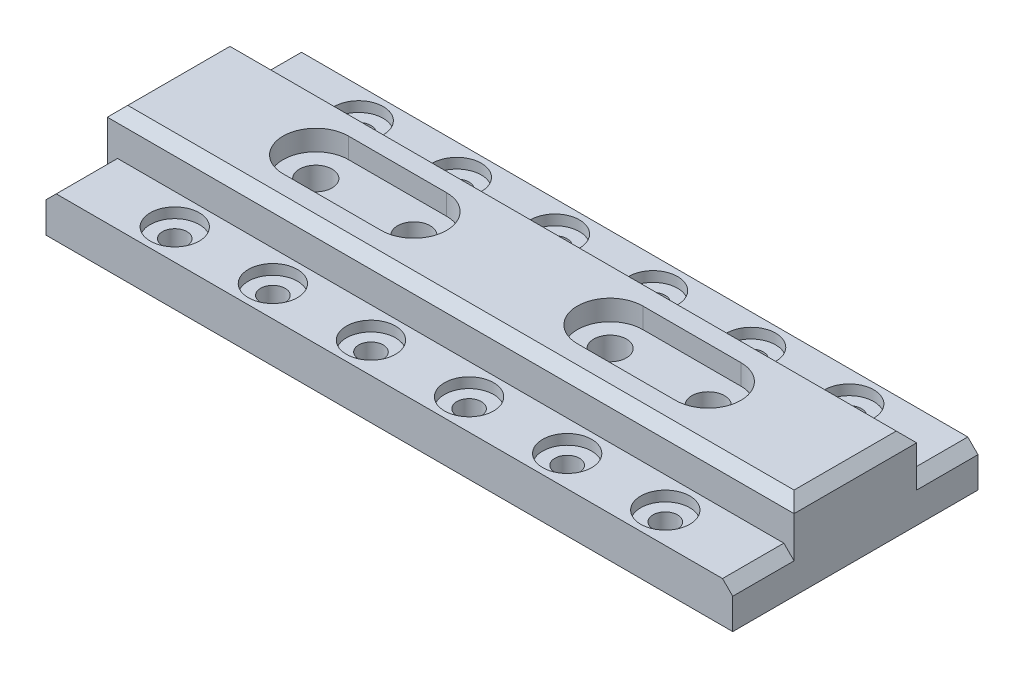
from build123d import *

# Parameters (mm, degrees)
BOSS_EXTRUDE1_DEPTH = 106.68
SKETCH3_R           = 3.81
CUT_EXTRUDE1_DEPTH  = 114.989132815
SKETCH5_R           = 7.62
CUT_EXTRUDE2_DEPTH  = 3.175
SKETCH6_R           = 5.08
CUT_EXTRUDE3_DEPTH  = 117.092172001
CUT_EXTRUDE4_DEPTH  = 6.35
CHAMFER1_SIZE       = 3.175


with BuildPart() as part:
    # Sketch1 → Boss-Extrude1 (new, symmetric)
    with BuildSketch(Plane(origin=(0, 0, 0), x_dir=(0, 0, -1), z_dir=(1, 0, 0))):
        Polygon((38.1, 0), (-38.1, 0), (-38.1, 12.7), (-19.05, 12.7), (-19.05, 25.4), (19.05, 25.4), (19.05, 12.7), (38.1, 12.7), align=None)
    extrude(amount=BOSS_EXTRUDE1_DEPTH, both=True)

    # Sketch3 → Cut-Extrude1 (cut, through all)
    with BuildSketch(Plane(origin=(0, 12.7, 0), x_dir=(1, 0, 0), z_dir=(0, 1, 0))):
        with Locations(Location((-76.2, -28.575, 0), (0, 0, 270))):
            Circle(SKETCH3_R)
        with Locations(Location((-45.72, -28.575, 0), (0, 0, 270))):
            Circle(SKETCH3_R)
        with Locations(Location((-15.24, -28.575, 0), (0, 0, 270))):
            Circle(SKETCH3_R)
        with Locations(Location((15.24, -28.575, 0), (0, 0, 270))):
            Circle(SKETCH3_R)
        with Locations(Location((45.72, -28.575, 0), (0, 0, 270))):
            Circle(SKETCH3_R)
        with Locations(Location((76.2, -28.575, 0), (0, 0, 270))):
            Circle(SKETCH3_R)
        with Locations(Location((76.2, 28.575, 0), (0, 0, 90))):
            Circle(SKETCH3_R)
        with Locations(Location((45.72, 28.575, 0), (0, 0, 90))):
            Circle(SKETCH3_R)
        with Locations(Location((15.24, 28.575, 0), (0, 0, 90))):
            Circle(SKETCH3_R)
        with Locations(Location((-15.24, 28.575, 0), (0, 0, 90))):
            Circle(SKETCH3_R)
        with Locations(Location((-45.72, 28.575, 0), (0, 0, 90))):
            Circle(SKETCH3_R)
        with Locations(Location((-76.2, 28.575, 0), (0, 0, 90))):
            Circle(SKETCH3_R)
    extrude(amount=-CUT_EXTRUDE1_DEPTH, mode=Mode.SUBTRACT)

    # Sketch5 → Cut-Extrude2 (cut)
    with BuildSketch(Plane(origin=(0, 12.7, 0), x_dir=(1, 0, 0), z_dir=(0, 1, 0))):
        with Locations(Location((-76.2, -28.575, 0), (0, 0, 270))):
            Circle(SKETCH5_R)
        with Locations(Location((-45.72, -28.575, 0), (0, 0, 270))):
            Circle(SKETCH5_R)
        with Locations(Location((-15.24, -28.575, 0), (0, 0, 270))):
            Circle(SKETCH5_R)
        with Locations(Location((15.24, -28.575, 0), (0, 0, 270))):
            Circle(SKETCH5_R)
        with Locations(Location((45.72, -28.575, 0), (0, 0, 270))):
            Circle(SKETCH5_R)
        with Locations(Location((76.2, -28.575, 0), (0, 0, 270))):
            Circle(SKETCH5_R)
        with Locations(Location((-45.72, 28.575, 0), (0, 0, 270))):
            Circle(SKETCH5_R)
        with Locations(Location((-15.24, 28.575, 0), (0, 0, 270))):
            Circle(SKETCH5_R)
        with Locations(Location((15.24, 28.575, 0), (0, 0, 270))):
            Circle(SKETCH5_R)
        with Locations(Location((45.72, 28.575, 0), (0, 0, 270))):
            Circle(SKETCH5_R)
        with Locations(Location((76.2, 28.575, 0), (0, 0, 270))):
            Circle(SKETCH5_R)
        with Locations(Location((-76.2, 28.575, 0), (0, 0, 270))):
            Circle(SKETCH5_R)
    extrude(amount=-CUT_EXTRUDE2_DEPTH, mode=Mode.SUBTRACT)

    # Sketch6 → Cut-Extrude3 (cut, through all)
    with BuildSketch(Plane(origin=(0, 25.4, 0), x_dir=(1, 0, 0), z_dir=(0, 1, 0))):
        with Locations(Location((-60.96, 0, 0), (0, 0, 270))):
            Circle(SKETCH6_R)
        with Locations(Location((-30.48, 0, 0), (0, 0, 270))):
            Circle(SKETCH6_R)
        with Locations(Location((30.48, 0, 0), (0, 0, 90))):
            Circle(SKETCH6_R)
        with Locations(Location((60.96, 0, 0), (0, 0, 90))):
            Circle(SKETCH6_R)
    extrude(amount=-CUT_EXTRUDE3_DEPTH, mode=Mode.SUBTRACT)

    # Sketch7 → Cut-Extrude4 (cut)
    with BuildSketch(Plane(origin=(0, 25.4, 0), x_dir=(1, 0, 0), z_dir=(0, 1, 0))):
        with BuildLine():
            Line((-60.96, 10.16), (-30.48, 10.16))
            ThreePointArc((-30.48, 10.16), (-20.32, 0), (-30.48, -10.16))
            Line((-30.48, -10.16), (-60.96, -10.16))
            ThreePointArc((-60.96, -10.16), (-71.12, 0), (-60.96, 10.16))
        make_face()
        with BuildLine():
            Line((30.48, 10.16), (60.96, 10.16))
            ThreePointArc((60.96, 10.16), (71.12, 0), (60.96, -10.16))
            Line((60.96, -10.16), (30.48, -10.16))
            ThreePointArc((30.48, -10.16), (20.32, 0), (30.48, 10.16))
        make_face()
    extrude(amount=-CUT_EXTRUDE4_DEPTH, mode=Mode.SUBTRACT)

    # Chamfer1
    chamfer1_edges = [part.edges().sort_by_distance(p)[0] for p in [
        (-106.68, 25.4, 0),
        (-106.68, 12.7, -28.575),
        (106.68, 25.4, 0),
        (0, 25.4, 19.05),
        (0, 25.4, -19.05),
        (106.68, 12.7, 28.575),
        (106.68, 12.7, -28.575),
        (-106.68, 12.7, 28.575),
    ]]
    chamfer(chamfer1_edges, length=CHAMFER1_SIZE)


solid = part.part
